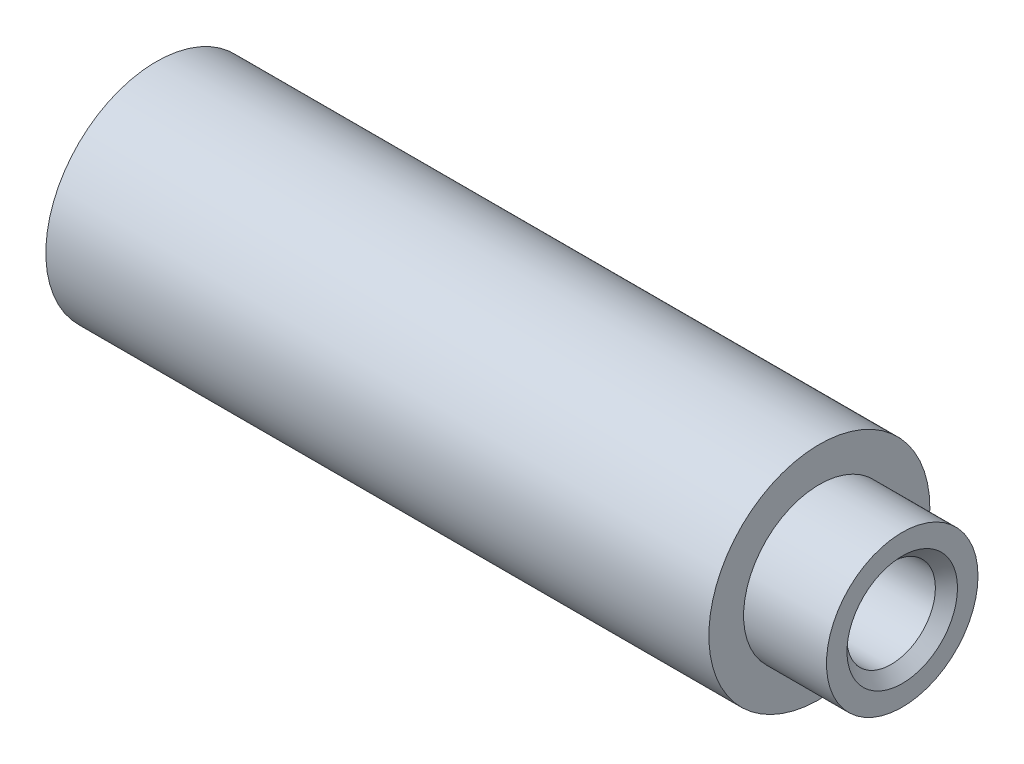
from build123d import *

# Parameters (mm, degrees)
SKIZZE1_R                       = 4
SKIZZE1_R_2                     = 1.6
AUFSATZ_LINEAR_AUSTRAGEN1_DEPTH = 27
SKIZZE2_OUTSIDE_W               = 15.854
SKIZZE2_OUTSIDE_H               = 15.854
SKIZZE2_OUTSIDE_R               = 2.7425
SCHNITT_LINEAR_AUSTRAGEN1_DEPTH = 3
FASE1_SIZE                      = 0.4


with BuildPart() as part:
    # Skizze1 → Aufsatz-Linear austragen1 (new body)
    with BuildSketch(Plane(origin=(0, 0, 0), x_dir=(0, 0, -1), z_dir=(1, 0, 0))):
        Circle(SKIZZE1_R)
        Circle(SKIZZE1_R_2, mode=Mode.SUBTRACT)
    extrude(amount=AUFSATZ_LINEAR_AUSTRAGEN1_DEPTH)

    # Skizze2 outside → Schnitt-Linear austragen1 (cut)
    with BuildSketch(Plane(origin=(27, 0, 0), x_dir=(0, 0, -1), z_dir=(1, 0, 0))):
        Rectangle(SKIZZE2_OUTSIDE_W, SKIZZE2_OUTSIDE_H)
        Circle(SKIZZE2_OUTSIDE_R, mode=Mode.SUBTRACT)
    extrude(amount=-SCHNITT_LINEAR_AUSTRAGEN1_DEPTH, mode=Mode.SUBTRACT)

    # Fase1
    fase1_edges = [part.edges().sort_by_distance(p)[0] for p in [
        (0, 0, 1.6),
        (27, 0, 1.6),
    ]]
    chamfer(fase1_edges, length=FASE1_SIZE)


solid = part.part
